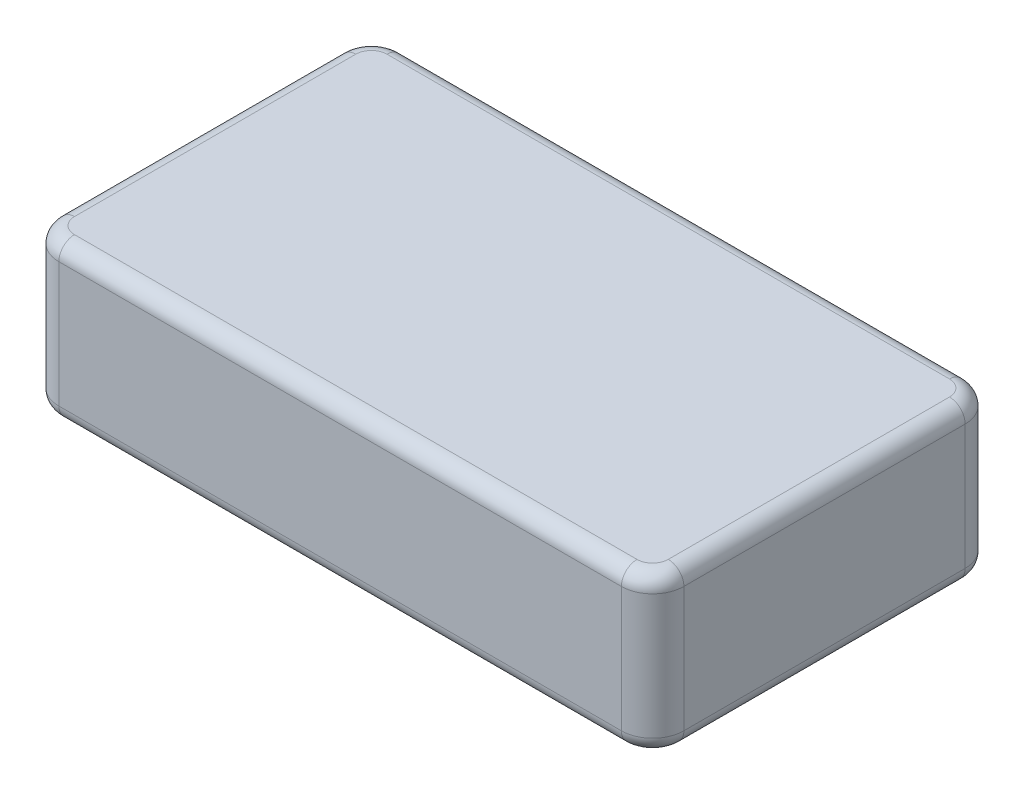
from build123d import *

# Parameters (mm, degrees)
SKETCH_1_W      = 40
SKETCH_1_H      = 22
EXTRUDE_1_DEPTH = 5
FILLET_1_R      = 2
FILLET_2_R      = 1
EXTRUDE_2_DEPTH = 0.5


with BuildPart() as part:
    # 草图1 → 凸台-拉伸1 (new, symmetric)
    with BuildSketch(Plane(origin=(0, 0, 0), x_dir=(1, 0, 0), z_dir=(0, 1, 0))):
        Rectangle(SKETCH_1_W, SKETCH_1_H)
    extrude(amount=EXTRUDE_1_DEPTH, both=True)

    # 圆角1
    fillet_1_edges = [part.edges().sort_by_distance(p)[0] for p in [
        (20, 0, 11),
        (-20, 0, 11),
        (-20, 0, -11),
        (20, 0, -11),
    ]]
    fillet(fillet_1_edges, radius=FILLET_1_R)

    # 圆角2
    fillet_2_edges = [part.edges().sort_by_distance(p)[0] for p in [
        (-20, -5, 0),
        (-20, 5, 0),
        (20, -5, 0),
        (0, -5, 11),
        (0, -5, -11),
        (-19.414213562, -5, 10.414213562),
        (19.414213562, -5, 10.414213562),
        (19.414213562, -5, -10.414213562),
        (-19.414213562, -5, -10.414213562),
        (0, 5, -11),
        (20, 5, 0),
        (0, 5, 11),
        (-19.414213562, 5, 10.414213562),
        (19.414213562, 5, 10.414213562),
        (19.414213562, 5, -10.414213562),
        (-19.414213562, 5, -10.414213562),
    ]]
    fillet(fillet_2_edges, radius=FILLET_2_R)

    # 草图2 → 凸台-拉伸2 (add)
    # profile 1 of 8: a face of its own
    with BuildSketch(Plane.XZ.offset(5)):
        with BuildLine():
            Line((-11.463180367, 4.470079286), (-11.35280321, 4.470079286))
            Line((-11.35280321, 4.470079286), (-11.363244292, -0.877246519))
            add(Edge.make_bspline(
                [(-11.363244292, -0.877246519), (-11.364433727, -0.925471097), (-11.366714337, -1.017936358), (-11.366899427, -1.150230165), (-11.371250251, -1.270009938), (-11.371596794, -1.377447166), (-11.374831997, -1.472401495), (-11.378573196, -1.554892793), (-11.378928682, -1.625075691), (-11.385546196, -1.734920983), (-11.39343184, -1.885950069), (-11.412987831, -2.04150746), (-11.428555871, -2.152348611), (-11.444382066, -2.20280544), (-11.464432231, -2.242728536), (-11.484442257, -2.238072767), (-11.493012032, -2.236078822)],
                knots=[0, 0, 0, 0, 1.45038606, 2.780953852, 3.977268029, 5.053718292, 6.010937745, 6.833690271, 7.536464333, 8.120251454, 10.142880859, 12.069479857, 12.873132744, 13.440417135, 13.76034519, 14, 14, 14, 14], degree=3))
            add(Edge.make_bspline(
                [(-11.493012032, -2.236078822), (-11.49499309, -2.234579297), (-11.503472504, -2.228160962), (-11.523693558, -2.214575707), (-11.547720341, -2.178159628), (-11.558237764, -2.145489513), (-11.564608026, -2.125701665)],
                knots=[0, 0, 0, 0, 0.221265066, 0.947068446, 2.150880552, 4, 4, 4, 4], degree=3))
            Line((-11.564608026, -2.125701665), (-11.613830272, -1.994442342))
            Line((-11.613830272, -1.994442342), (-11.725699012, -1.631987622))
            add(Edge.make_bspline(
                [(-11.725699012, -1.631987622), (-11.739165596, -1.597884368), (-11.762623689, -1.538478259), (-11.786287728, -1.460321271), (-11.804240066, -1.410414734), (-11.809011652, -1.369963314), (-11.786026897, -1.332019775), (-11.769099414, -1.273598294), (-11.743052539, -1.199027119), (-11.718455368, -1.111012925), (-11.696730265, -1.015914979), (-11.677159735, -0.913164637), (-11.666068554, -0.797399171), (-11.660627898, -0.686867453), (-11.656452518, -0.580448584), (-11.655693916, -0.477996857), (-11.65360159, -0.356690879), (-11.653928451, -0.269179111), (-11.654103018, -0.22244149)],
                knots=[0, 0, 0, 0, 1.220359697, 2.125803599, 2.712350858, 2.994193817, 3.439826662, 4.12562012, 5.031064022, 6.063176816, 7.167225426, 8.277459231, 9.542238136, 11.034069985, 11.961482632, 13.08703073, 14.444263491, 16, 16, 16, 16], degree=3))
            Line((-11.654103018, -0.22244149), (-11.645153519, 3.724287681))
            Line((-11.645153519, 3.724287681), (-12.168699225, 3.270846386))
            Line((-12.168699225, 3.270846386), (-12.208971972, 3.442378455))
            add(Edge.make_bspline(
                [(-12.208971972, 3.442378455), (-12.166415094, 3.486352693), (-12.086640472, 3.568784216), (-11.980026215, 3.687470795), (-11.892339718, 3.790471946), (-11.801008381, 3.910885116), (-11.69875253, 4.060738558), (-11.623239811, 4.183854517), (-11.583998607, 4.247833388)],
                knots=[0, 0, 0, 0, 1.077185482, 2.019228619, 2.808185376, 3.45765616, 4.678836699, 6, 6, 6, 6], degree=3))
            Line((-11.583998607, 4.247833388), (-11.463180367, 4.470079286))
        make_face()
    # profile 2 of 8: a face of its own
    with BuildSketch(Plane.XZ.offset(5)):
        with BuildLine():
            Line((-7.252440968, 3.804833174), (-7.15101331, 4.419365457))
            Line((-7.15101331, 4.419365457), (-7.051077235, 4.408924374))
            Line((-7.051077235, 4.408924374), (-7.051077235, 1.8926235))
            Line((-7.051077235, 1.8926235), (-7.171895475, 1.882182418))
            Line((-7.171895475, 1.882182418), (-7.241999886, 2.948664412))
            add(Edge.make_bspline(
                [(-7.241999886, 2.948664412), (-7.251230124, 3.007968799), (-7.268292508, 3.117594818), (-7.301738404, 3.266053077), (-7.332759539, 3.387541669), (-7.380828306, 3.510659482), (-7.452159697, 3.642103754), (-7.557230502, 3.782991336), (-7.683296615, 3.909902274), (-7.832796244, 4.009735), (-7.99483236, 4.086035606), (-8.111329585, 4.10053655), (-8.168273059, 4.107624566)],
                knots=[0, 0, 0, 0, 1.116474761, 2.063838624, 2.831507158, 3.446633667, 4.518832044, 5.603216916, 6.708904972, 7.82779241, 8.938231816, 10, 10, 10, 10], degree=3))
            add(Edge.make_bspline(
                [(-8.168273059, 4.107624566), (-8.202199609, 4.106170345), (-8.271854791, 4.10318466), (-8.359291092, 4.08262072), (-8.433807942, 4.05534785), (-8.49543369, 4.020260484), (-8.563216797, 3.973267463), (-8.634025203, 3.914929994), (-8.70522405, 3.848270132), (-8.768370699, 3.770801267), (-8.823805048, 3.68596951), (-8.883248321, 3.563689316), (-8.94244072, 3.407835835), (-8.981570995, 3.24641308), (-8.998674889, 3.111472788), (-9.009180932, 2.997545733), (-9.015927404, 2.869677371), (-9.021846248, 2.731415628), (-9.016759472, 2.588972316), (-8.996234561, 2.449675575), (-8.959281819, 2.3171441), (-8.922080401, 2.234784536), (-8.903623581, 2.193923309)],
                knots=[0, 0, 0, 0, 0.864038106, 1.773971445, 2.275285977, 2.88209936, 3.574564674, 4.376127188, 5.218616224, 6.055847121, 6.916999662, 7.795414815, 9.515900782, 11.157236165, 12.013901558, 12.981067707, 14.072720019, 15.277182195, 16.507433409, 17.699229733, 18.858513907, 20, 20, 20, 20], degree=3))
            add(Edge.make_bspline(
                [(-8.903623581, 2.193923309), (-8.882726653, 2.156032051), (-8.841974449, 2.082138303), (-8.765758207, 1.983759812), (-8.676249517, 1.904026448), (-8.550524343, 1.822791793), (-8.39971426, 1.750189319), (-8.28084123, 1.702183733), (-8.227936387, 1.680818685)],
                knots=[0, 0, 0, 0, 0.892298636, 1.740118821, 2.553971753, 3.353728668, 4.822268012, 6, 6, 6, 6], degree=3))
            Line((-8.227936387, 1.680818685), (-7.87592275, 1.53911828))
            add(Edge.make_bspline(
                [(-7.87592275, 1.53911828), (-7.83249313, 1.519089293), (-7.748872161, 1.480524754), (-7.631016113, 1.419174004), (-7.524313447, 1.358506249), (-7.401541829, 1.276335251), (-7.266262163, 1.168413003), (-7.132590938, 1.019572858), (-7.023970429, 0.850894785), (-6.9558369, 0.654218539), (-6.902174113, 0.440857725), (-6.865940441, 0.209071692), (-6.842017735, -0.043979631), (-6.832402249, -0.314712767), (-6.836660716, -0.594482192), (-6.872423567, -0.7771162), (-6.889986249, -0.866805436)],
                knots=[0, 0, 0, 0, 0.703245545, 1.354054533, 1.953549274, 2.507188807, 3.525842386, 4.488918984, 5.43838142, 6.454223102, 7.53246407, 8.673253088, 9.899948524, 11.268249991, 12.658472344, 14, 14, 14, 14], degree=3))
            add(Edge.make_bspline(
                [(-6.889986249, -0.866805436), (-6.911945081, -0.956752212), (-6.954478009, -1.130973658), (-7.046499098, -1.33114094), (-7.127161499, -1.472686505), (-7.186918057, -1.564418114), (-7.246670865, -1.643249008), (-7.324763586, -1.735762158), (-7.445204521, -1.833283983), (-7.585722589, -1.910941335), (-7.71506889, -1.959222455), (-7.822430981, -1.986825077), (-7.937703924, -2.000815947), (-8.017094569, -2.003502646), (-8.057895901, -2.004883425)],
                knots=[0, 0, 0, 0, 1.868422262, 3.619020558, 4.429541533, 5.162879566, 5.830420081, 6.429075538, 7.606854402, 8.938752151, 9.657684361, 10.394048182, 11.174651193, 12, 12, 12, 12], degree=3))
            add(Edge.make_bspline(
                [(-8.057895901, -2.004883425), (-8.103713806, -2.004591956), (-8.193393601, -2.004021462), (-8.324601132, -1.982799772), (-8.448417204, -1.943958618), (-8.56371719, -1.886206875), (-8.671552224, -1.814074832), (-8.771702968, -1.728509937), (-8.864326934, -1.630415114), (-8.951791094, -1.521687921), (-9.028402709, -1.398915711), (-9.097628977, -1.265389106), (-9.156840309, -1.120421395), (-9.223225376, -0.915823375), (-9.281560046, -0.655911406), (-9.298245385, -0.445484278), (-9.306351047, -0.34325973)],
                knots=[0, 0, 0, 0, 0.833862414, 1.63212638, 2.411403016, 3.189256699, 3.973153178, 4.770028097, 5.583768076, 6.428386665, 7.307987397, 8.215552436, 9.166047206, 10.157242313, 12.13320567, 14, 14, 14, 14], degree=3))
            Line((-9.306351047, -0.34325973), (-9.346623794, 0.190727059))
            Line((-9.346623794, 0.190727059), (-9.204923389, 0.190727059))
            add(Edge.make_bspline(
                [(-9.204923389, 0.190727059), (-9.196772342, 0.12754067), (-9.181090881, 0.005979003), (-9.153537365, -0.169375458), (-9.126979253, -0.331018364), (-9.093030426, -0.524196273), (-9.039920895, -0.742411992), (-8.956252369, -0.979559783), (-8.846993993, -1.187676192), (-8.730263854, -1.333871748), (-8.629879718, -1.435582083), (-8.549852047, -1.49397606), (-8.471895104, -1.544420245), (-8.366240942, -1.587565317), (-8.234595809, -1.622038622), (-8.128714356, -1.621707412), (-8.077286483, -1.62154654)],
                knots=[0, 0, 0, 0, 1.134650933, 2.182907786, 3.161205505, 4.052250561, 5.675932663, 7.155002512, 8.52184542, 9.839854562, 10.472309825, 11.060302883, 11.600982628, 12.120735338, 13.087218943, 14, 14, 14, 14], degree=3))
            add(Edge.make_bspline(
                [(-8.077286483, -1.62154654), (-8.031892636, -1.619923985), (-7.944815156, -1.616811493), (-7.820289544, -1.590381088), (-7.706854122, -1.54987681), (-7.606904915, -1.487707716), (-7.517269334, -1.41266666), (-7.436389276, -1.32489877), (-7.362262679, -1.226042939), (-7.300448189, -1.115062073), (-7.245876258, -1.000342763), (-7.201023956, -0.886322047), (-7.167753355, -0.774994556), (-7.145196966, -0.665098586), (-7.129898017, -0.551454266), (-7.122101588, -0.430384314), (-7.116415775, -0.299030258), (-7.119547333, -0.208521661), (-7.121181646, -0.161286578)],
                knots=[0, 0, 0, 0, 1.108065456, 2.12556444, 3.098260599, 4.035950869, 4.98490885, 5.94776606, 6.946521194, 7.996930623, 9.045863326, 10.049925535, 10.987930625, 11.881525266, 12.788809675, 13.787786499, 14.845478855, 16, 16, 16, 16], degree=3))
            add(Edge.make_bspline(
                [(-7.121181646, -0.161286578), (-7.126403599, -0.087563248), (-7.136149978, 0.050035759), (-7.167755212, 0.239418723), (-7.206335914, 0.398492316), (-7.257818683, 0.529244622), (-7.320365384, 0.637345224), (-7.386100027, 0.734509944), (-7.460190371, 0.821150517), (-7.544608464, 0.896624932), (-7.637352498, 0.966590798), (-7.741777681, 1.031653936), (-7.858738474, 1.093459016), (-7.942736644, 1.128604625), (-7.986299907, 1.146831896)],
                knots=[0, 0, 0, 0, 1.578487453, 2.946127177, 4.097996722, 5.070650713, 5.936469873, 6.761635482, 7.575228913, 8.364955199, 9.176673428, 10.055112166, 10.991339211, 12, 12, 12, 12], degree=3))
            Line((-7.986299907, 1.146831896), (-8.420350621, 1.307922883))
            add(Edge.make_bspline(
                [(-8.420350621, 1.307922883), (-8.487892576, 1.337447953), (-8.621732798, 1.395954433), (-8.804413358, 1.514283086), (-8.963594882, 1.657526044), (-9.091779511, 1.831402315), (-9.190214766, 2.033848681), (-9.250352887, 2.223514755), (-9.283849163, 2.393915365), (-9.298752274, 2.539161665), (-9.308542739, 2.698941461), (-9.307104871, 2.809931009), (-9.306351047, 2.868118919)],
                knots=[0, 0, 0, 0, 1.141640751, 2.262259852, 3.359181592, 4.444772656, 5.58953336, 6.835542724, 7.519006772, 8.279340868, 9.097919025, 10, 10, 10, 10], degree=3))
            add(Edge.make_bspline(
                [(-9.306351047, 2.868118919), (-9.305925963, 2.918353807), (-9.305104238, 3.015462225), (-9.294660511, 3.155946738), (-9.276914968, 3.285422168), (-9.245118936, 3.443489249), (-9.188221608, 3.629118093), (-9.099836865, 3.836926601), (-8.997415409, 4.022544305), (-8.879669535, 4.178198258), (-8.745240753, 4.299897857), (-8.622852218, 4.38414771), (-8.511672335, 4.434185755), (-8.41633746, 4.461240875), (-8.310373872, 4.475016823), (-8.236422821, 4.47765948), (-8.198104723, 4.479028785)],
                knots=[0, 0, 0, 0, 0.971164436, 1.877345498, 2.721647718, 3.496542433, 4.992871533, 6.466013358, 7.856401207, 9.083219229, 10.219456221, 11.349985082, 11.939558551, 12.569451447, 13.258754286, 14, 14, 14, 14], degree=3))
            add(Edge.make_bspline(
                [(-8.198104723, 4.479028785), (-8.155156342, 4.474143087), (-8.069737866, 4.464426099), (-7.944449387, 4.430469728), (-7.823247224, 4.381714194), (-7.710055296, 4.31552773), (-7.605953866, 4.241830743), (-7.512285006, 4.165336614), (-7.435727596, 4.082571345), (-7.393597122, 4.024020467), (-7.373259208, 3.995755825)],
                knots=[0, 0, 0, 0, 1.049956055, 2.088219507, 3.145806661, 4.218152357, 5.268178035, 6.24663062, 7.15358473, 8, 8, 8, 8], degree=3))
            Line((-7.373259208, 3.995755825), (-7.252440968, 3.804833174))
        make_face()
    # profile 3 of 8: a face of its own
    with BuildSketch(Plane.XZ.offset(5)):
        with BuildLine():
            Line((-6.080056566, 0.38164971), (-5.980120491, 0.553181779))
            add(Edge.make_bspline(
                [(-5.980120491, 0.553181779), (-5.973229734, 0.568130989), (-5.957309316, 0.602669674), (-5.928208924, 0.66073814), (-5.894885993, 0.733300376), (-5.854011101, 0.819265294), (-5.805942301, 0.918805937), (-5.753463044, 1.033476572), (-5.690988637, 1.160391311), (-5.60485126, 1.344271223), (-5.497936478, 1.567842797), (-5.38483143, 1.819527028), (-5.287960726, 2.039117584), (-5.203237604, 2.239245105), (-5.12351115, 2.443153311), (-5.035497159, 2.672175726), (-4.937099562, 2.938889275), (-4.830591917, 3.232020715), (-4.724543816, 3.53179601), (-4.630420371, 3.818210376), (-4.550850014, 4.080677594), (-4.486305585, 4.320604962), (-4.434340862, 4.539724107), (-4.389711126, 4.73968668), (-4.358247011, 4.92244518), (-4.344401867, 5.03880897), (-4.337887378, 5.093561067)],
                knots=[0, 0, 0, 0, 0.244516093, 0.564930459, 0.96472419, 1.430561812, 1.978960196, 2.606759885, 3.303777118, 4.080173153, 5.623132533, 6.985021271, 8.17890921, 9.188507767, 10.21304389, 11.431087032, 12.833237307, 14.436024036, 16.06415384, 17.556631416, 18.914207354, 20.137880512, 21.24677126, 22.25939112, 23.180999631, 24, 24, 24, 24], degree=3))
            Line((-4.337887378, 5.093561067), (-4.308055714, 5.476897952))
            Line((-4.308055714, 5.476897952), (-4.217069138, 5.53656128))
            Line((-4.217069138, 5.53656128), (-3.945600994, 4.872806752))
            Line((-3.945600994, 4.872806752), (-3.885937666, 4.720665265))
            add(Edge.make_bspline(
                [(-3.885937666, 4.720665265), (-3.889208177, 4.71211331), (-3.897421407, 4.690636797), (-3.920004244, 4.654323621), (-3.953770631, 4.607830155), (-3.991286325, 4.562317687), (-4.026499047, 4.515134841), (-4.053477025, 4.463591072), (-4.085282997, 4.400688388), (-4.119209883, 4.325064582), (-4.154557279, 4.236648468), (-4.193676511, 4.13633208), (-4.23530177, 4.022902001), (-4.292706379, 3.859222047), (-4.361571538, 3.659763991), (-4.436871458, 3.437216326), (-4.507704971, 3.244592827), (-4.550751823, 3.124694381), (-4.570574358, 3.069482652)],
                knots=[0, 0, 0, 0, 0.244348517, 0.613632105, 1.137397843, 1.780870594, 2.190305121, 2.707964573, 3.332066687, 4.075639541, 4.922191972, 5.877374831, 6.953848167, 8.151865336, 10.514042256, 12.594594908, 14.431853713, 16, 16, 16, 16], degree=3))
            add(Edge.make_bspline(
                [(-4.570574358, 3.069482652), (-4.48465527, 3.086242071), (-4.31841651, 3.118668683), (-4.082637453, 3.192741427), (-3.866753275, 3.283582265), (-3.737400627, 3.3631757), (-3.67413285, 3.402105708)],
                knots=[0, 0, 0, 0, 1.090250196, 2.109447895, 3.075310551, 4, 4, 4, 4], degree=3))
            Line((-3.67413285, 3.402105708), (-3.392223623, 3.109755399))
            add(Edge.make_bspline(
                [(-3.392223623, 3.109755399), (-3.38073074, 3.095927622), (-3.359909509, 3.070876351), (-3.333292413, 3.036746084), (-3.320462645, 3.006467616), (-3.313905355, 2.974679614), (-3.340666332, 2.937656371), (-3.373037261, 2.932393282), (-3.392223623, 2.929273831)],
                knots=[0, 0, 0, 0, 1.306481079, 2.366903289, 3.110205161, 3.69158161, 4.631792372, 6, 6, 6, 6], degree=3))
            Line((-3.392223623, 2.929273831), (-4.369210625, 2.757741762))
            Line((-4.369210625, 2.757741762), (-4.721224263, 2.677196268))
            add(Edge.make_bspline(
                [(-4.721224263, 2.677196268), (-4.752914498, 2.603555279), (-4.812142717, 2.465922203), (-4.89674948, 2.274564978), (-4.972494327, 2.113492275), (-5.021342399, 2.016829784), (-5.043406236, 1.973168994)],
                knots=[0, 0, 0, 0, 1.242291702, 2.321810586, 3.241990604, 4, 4, 4, 4], degree=3))
            Line((-5.043406236, 1.973168994), (-5.234328887, 1.579391027))
            Line((-5.234328887, 1.579391027), (-5.395419873, 1.248259554))
            Line((-5.395419873, 1.248259554), (-5.164224476, 1.267650136))
            Line((-5.164224476, 1.267650136), (-4.812210838, 1.328805047))
            Line((-4.812210838, 1.328805047), (-4.428873954, 1.41830004))
            add(Edge.make_bspline(
                [(-4.428873954, 1.41830004), (-4.360072182, 1.435517853), (-4.228101185, 1.468543919), (-4.041866887, 1.526678452), (-3.874971317, 1.588364105), (-3.773265491, 1.636852692), (-3.724846679, 1.65993652)],
                knots=[0, 0, 0, 0, 1.140766297, 2.188142296, 3.137433886, 4, 4, 4, 4], degree=3))
            Line((-3.724846679, 1.65993652), (-3.43249637, 1.409350541))
            add(Edge.make_bspline(
                [(-3.43249637, 1.409350541), (-3.415847991, 1.391726651), (-3.387168405, 1.361366585), (-3.3638708, 1.306471829), (-3.388967822, 1.255703405), (-3.423001176, 1.251009298), (-3.442937452, 1.248259554)],
                knots=[0, 0, 0, 0, 1.314229091, 2.263977021, 2.983061283, 4, 4, 4, 4], degree=3))
            Line((-3.442937452, 1.248259554), (-3.966483159, 1.157272978))
            Line((-3.966483159, 1.157272978), (-4.358769543, 1.066286403))
            Line((-4.358769543, 1.066286403), (-4.358769543, -0.273155319))
            add(Edge.make_bspline(
                [(-4.358769543, -0.273155319), (-4.28699984, -0.252850609), (-4.149563582, -0.213967861), (-3.956295827, -0.149459154), (-3.785510591, -0.079666484), (-3.682725071, -0.02580278), (-3.633860103, -0.000195592)],
                knots=[0, 0, 0, 0, 1.152651784, 2.207284424, 3.147730245, 4, 4, 4, 4], degree=3))
            Line((-3.633860103, -0.000195592), (-3.392223623, -0.273155319))
            add(Edge.make_bspline(
                [(-3.392223623, -0.273155319), (-3.375404327, -0.293837289), (-3.346691993, -0.329143619), (-3.330818736, -0.38930449), (-3.352462809, -0.4408557), (-3.38486158, -0.449104288), (-3.402664706, -0.453636887)],
                knots=[0, 0, 0, 0, 1.37897393, 2.354055748, 3.095553551, 4, 4, 4, 4], degree=3))
            Line((-3.402664706, -0.453636887), (-3.894887165, -0.544623463))
            Line((-3.894887165, -0.544623463), (-4.388601207, -0.644559538))
            Line((-4.388601207, -0.644559538), (-4.428873954, -2.960988262))
            Line((-4.428873954, -2.960988262), (-3.351950877, -1.86318302))
            Line((-3.351950877, -1.86318302), (-3.281846466, -2.013832924))
            add(Edge.make_bspline(
                [(-3.281846466, -2.013832924), (-3.372953979, -2.132570203), (-3.549597128, -2.362783127), (-3.804405153, -2.698960839), (-4.043016217, -3.012470028), (-4.194826444, -3.215452949), (-4.267782967, -3.313001899)],
                knots=[0, 0, 0, 0, 1.101182503, 2.135019819, 3.103733175, 4, 4, 4, 4], degree=3))
            Line((-4.267782967, -3.313001899), (-4.519860529, -3.665015536))
            add(Edge.make_bspline(
                [(-4.519860529, -3.665015536), (-4.540089633, -3.692381208), (-4.574519436, -3.7389574), (-4.602749446, -3.801700509), (-4.634504305, -3.835712586), (-4.63102993, -3.853397234), (-4.630237687, -3.85742977)],
                knots=[0, 0, 0, 0, 1.798205281, 3.060533554, 3.785778425, 4, 4, 4, 4], degree=3))
            Line((-4.630237687, -3.85742977), (-4.700342098, -3.766443195))
            Line((-4.700342098, -3.766443195), (-4.901705831, -3.535247797))
            add(Edge.make_bspline(
                [(-4.901705831, -3.535247797), (-4.914551792, -3.519838111), (-4.937116539, -3.492770018), (-4.967187122, -3.457819581), (-4.982321117, -3.430840754), (-4.991431009, -3.407592493), (-4.975473716, -3.384822903), (-4.952474188, -3.357286782), (-4.917605123, -3.314924583), (-4.867844788, -3.266500769), (-4.816445329, -3.200078016), (-4.776743413, -3.112390625), (-4.747639384, -3.007689886), (-4.725189642, -2.849120234), (-4.705782606, -2.65406311), (-4.695963629, -2.499128308), (-4.691392598, -2.427001473)],
                knots=[0, 0, 0, 0, 0.696593583, 1.223610949, 1.578128759, 1.791090136, 2.02207918, 2.463047155, 3.073701498, 3.901904514, 4.872944166, 5.958838381, 7.21224812, 8.624664229, 11.497618683, 14, 14, 14, 14], degree=3))
            Line((-4.691392598, -2.427001473), (-4.651119852, -0.725105031))
            add(Edge.make_bspline(
                [(-4.651119852, -0.725105031), (-4.795383383, -0.762101117), (-5.077732688, -0.834509014), (-5.359195369, -0.910289647), (-5.496847531, -0.94735093)],
                knots=[0, 0, 0, 0, 1.021879835, 2, 2, 2, 2], degree=3))
            Line((-5.496847531, -0.94735093), (-5.787706257, -0.655000621))
            add(Edge.make_bspline(
                [(-5.787706257, -0.655000621), (-5.79609914, -0.644501058), (-5.812590529, -0.623870201), (-5.826917446, -0.59161496), (-5.818617634, -0.560929022), (-5.789678431, -0.546504448), (-5.749990031, -0.533158597), (-5.717328316, -0.527218225), (-5.698211265, -0.523741298)],
                knots=[0, 0, 0, 0, 1.068064254, 2.09866661, 2.632698737, 3.395044859, 4.475307756, 6, 6, 6, 6], degree=3))
            Line((-5.698211265, -0.523741298), (-5.505797031, -0.504350716))
            add(Edge.make_bspline(
                [(-5.505797031, -0.504350716), (-5.425177588, -0.494984529), (-5.270505899, -0.477015116), (-5.048708234, -0.441914135), (-4.847099216, -0.397486467), (-4.72055885, -0.360797828), (-4.660069351, -0.34325973)],
                knots=[0, 0, 0, 0, 1.129412521, 2.166823975, 3.123695448, 4, 4, 4, 4], degree=3))
            Line((-4.660069351, -0.34325973), (-4.660069351, 1.026013656))
            add(Edge.make_bspline(
                [(-4.660069351, 1.026013656), (-4.694309754, 1.017276624), (-4.751231986, 1.002751931), (-4.808701511, 0.990587912), (-4.83160142, 0.985740909)],
                knots=[0, 0, 0, 0, 1.203059061, 2, 2, 2, 2], degree=3))
            Line((-4.83160142, 0.985740909), (-5.062796817, 0.915636499))
            Line((-5.062796817, 0.915636499), (-5.204497222, 0.875363752))
            Line((-5.204497222, 0.875363752), (-5.446133702, 1.146831896))
            add(Edge.make_bspline(
                [(-5.446133702, 1.146831896), (-5.457298751, 1.131067014), (-5.485228638, 1.09163043), (-5.528042993, 1.015370715), (-5.590607612, 0.917206799), (-5.658552025, 0.797572626), (-5.730303946, 0.67506333), (-5.798343862, 0.562747493), (-5.85543966, 0.466132599), (-5.892008367, 0.407934624), (-5.908524497, 0.38164971)],
                knots=[0, 0, 0, 0, 0.51821696, 1.296343826, 2.344566462, 3.642306328, 4.988078142, 6.155268441, 7.166833366, 8, 8, 8, 8], degree=3))
            Line((-5.908524497, 0.38164971), (-5.98906999, 0.271272552))
            Line((-5.98906999, 0.271272552), (-6.080056566, 0.38164971))
        make_face()
    # profile 4 of 8: a face of its own
    with BuildSketch(Plane.XZ.offset(5)):
        with BuildLine():
            Line((-2.002068073, -3.374156811), (-2.002068073, -1.752805862))
            add(Edge.make_bspline(
                [(-2.002068073, -1.752805862), (-2.06824303, -1.763467317), (-2.207785282, -1.785948983), (-2.427759908, -1.827400946), (-2.670474149, -1.873202189), (-2.83986791, -1.90679343), (-2.928341245, -1.924337931)],
                knots=[0, 0, 0, 0, 0.853755862, 1.800303615, 2.851111907, 4, 4, 4, 4], degree=3))
            Line((-2.928341245, -1.924337931), (-3.120755479, -1.702092033))
            add(Edge.make_bspline(
                [(-3.120755479, -1.702092033), (-3.136835225, -1.683885093), (-3.164880055, -1.652130205), (-3.198740473, -1.609345002), (-3.217145685, -1.577795787), (-3.224696129, -1.546680701), (-3.197915568, -1.52111765), (-3.174246798, -1.514734342), (-3.161028226, -1.511169383)],
                knots=[0, 0, 0, 0, 1.696127462, 2.958231267, 3.780199993, 4.270545426, 5.034131512, 6, 6, 6, 6], degree=3))
            Line((-3.161028226, -1.511169383), (-2.536054861, -1.450014471))
            Line((-2.536054861, -1.450014471), (-1.982677491, -1.37991006))
            Line((-1.982677491, -1.37991006), (-1.982677491, 0.14001323))
            Line((-1.982677491, 0.14001323), (-2.777691341, 0.059467737))
            Line((-2.777691341, 0.059467737), (-2.788132424, -0.262714237))
            add(Edge.make_bspline(
                [(-2.788132424, -0.262714237), (-2.787781378, -0.295039368), (-2.787138494, -0.354237636), (-2.791072399, -0.434740658), (-2.793231512, -0.498485073), (-2.797392337, -0.545799283), (-2.803193453, -0.579632737), (-2.81072664, -0.601861252), (-2.822820441, -0.616935768), (-2.842555464, -0.616181502), (-2.860045781, -0.594625786), (-2.879590839, -0.559014293), (-2.902830597, -0.502778898), (-2.919076931, -0.459134246), (-2.928341245, -0.434246306)],
                knots=[0, 0, 0, 0, 2.014923643, 3.690007919, 5.024398433, 5.98985136, 6.652530555, 7.153331904, 7.460204618, 7.770192871, 8.231023539, 9.092322426, 10.341925023, 12, 12, 12, 12], degree=3))
            Line((-2.928341245, -0.434246306), (-3.110314397, 0.049026654))
            add(Edge.make_bspline(
                [(-3.110314397, 0.049026654), (-3.122801024, 0.078638524), (-3.144698358, 0.13056776), (-3.16621795, 0.199738515), (-3.18479119, 0.243982732), (-3.192466076, 0.274161097), (-3.187567668, 0.299325857), (-3.175227729, 0.329159052), (-3.162259694, 0.372564212), (-3.127054439, 0.447638899), (-3.093120356, 0.569655519), (-3.078841579, 0.740850648), (-3.070284587, 0.930048167), (-3.063179799, 1.061313051), (-3.059600568, 1.127441314)],
                knots=[0, 0, 0, 0, 1.042973245, 1.829023414, 2.3447337, 2.607467447, 2.819750817, 3.161742933, 3.656837014, 4.28628164, 5.849242264, 7.733156719, 9.850461401, 12, 12, 12, 12], degree=3))
            Line((-3.059600568, 1.127441314), (-3.049159485, 1.439182205))
            add(Edge.make_bspline(
                [(-3.049159485, 1.439182205), (-3.049159485, 1.445645732), (-3.049159485, 1.459069981), (-3.049159485, 1.47249423), (-3.049159485, 1.479454952)],
                knots=[0, 0, 0, 0, 0.962962963, 2, 2, 2, 2], degree=3))
            Line((-3.049159485, 1.479454952), (-3.07004165, 2.244637138))
            Line((-3.07004165, 2.244637138), (-3.089432232, 3.302169633))
            add(Edge.make_bspline(
                [(-3.089432232, 3.302169633), (-3.091446471, 3.329016063), (-3.096293931, 3.393624581), (-3.104016091, 3.506947456), (-3.110258796, 3.65274958), (-3.121112662, 3.817713073), (-3.129011812, 3.977343892), (-3.135397198, 4.106103905), (-3.138112001, 4.191652126), (-3.13964204, 4.233912211), (-3.140146061, 4.247833388)],
                knots=[0, 0, 0, 0, 0.682236145, 1.641866936, 2.87822235, 4.380152655, 5.831064009, 6.928377034, 7.646989543, 8, 8, 8, 8], degree=3))
            Line((-3.140146061, 4.247833388), (-3.180418808, 4.661001936))
            Line((-3.180418808, 4.661001936), (-3.07004165, 4.701274683))
            Line((-3.07004165, 4.701274683), (-2.838846253, 3.874937585))
            Line((-2.838846253, 3.874937585), (-1.800704339, 4.01663799))
            Line((-1.800704339, 4.01663799), (-0.744663427, 4.167287894))
            Line((-0.744663427, 4.167287894), (-0.532858612, 4.519301532))
            add(Edge.make_bspline(
                [(-0.532858612, 4.519301532), (-0.526264984, 4.532707724), (-0.515115224, 4.555377467), (-0.486816229, 4.578383965), (-0.459498433, 4.569200321), (-0.434352081, 4.549966838), (-0.405850389, 4.513793513), (-0.38415874, 4.485972011), (-0.371767625, 4.470079286)],
                knots=[0, 0, 0, 0, 1.175015506, 1.986940007, 2.463021564, 3.263923954, 4.437046816, 6, 6, 6, 6], degree=3))
            Line((-0.371767625, 4.470079286), (-0.210676638, 4.247833388))
            add(Edge.make_bspline(
                [(-0.210676638, 4.247833388), (-0.194131331, 4.222119865), (-0.165422475, 4.17750263), (-0.129795791, 4.117975911), (-0.108522579, 4.077293371), (-0.092684826, 4.047657434), (-0.101590728, 4.017932967), (-0.120554108, 3.982119158), (-0.156518193, 3.933638577), (-0.184340931, 3.896279912), (-0.200235556, 3.874937585)],
                knots=[0, 0, 0, 0, 1.689223804, 2.931083985, 3.802331103, 4.271022733, 4.69059203, 5.426565263, 6.529843446, 8, 8, 8, 8], degree=3))
            add(Edge.make_bspline(
                [(-0.200235556, 3.874937585), (-0.22802328, 3.837285635), (-0.283392431, 3.762261263), (-0.325440359, 3.647220042), (-0.345800666, 3.536752681), (-0.36149624, 3.424191499), (-0.378178314, 3.28202797), (-0.386569207, 3.177411485), (-0.391158207, 3.120196482)],
                knots=[0, 0, 0, 0, 1.059771852, 2.111675951, 2.745759835, 3.613886148, 4.695028686, 6, 6, 6, 6], degree=3))
            Line((-0.391158207, 3.120196482), (-0.583572441, 0.754545512))
            Line((-0.583572441, 0.754545512), (-0.391158207, 0.542740696))
            add(Edge.make_bspline(
                [(-0.391158207, 0.542740696), (-0.376348614, 0.524596768), (-0.350180581, 0.492537081), (-0.32040428, 0.446995073), (-0.299366632, 0.412414346), (-0.295447795, 0.378148813), (-0.303154815, 0.349555599), (-0.319155077, 0.325754444), (-0.344502805, 0.317205164), (-0.377016394, 0.312056274), (-0.424409676, 0.306230885), (-0.461259375, 0.302958765), (-0.482144783, 0.301104216)],
                knots=[0, 0, 0, 0, 1.694644542, 2.994377575, 3.961649825, 4.578694048, 5.435547803, 6.077366126, 6.545991535, 7.316612075, 8.47912864, 10, 10, 10, 10], degree=3))
            Line((-0.482144783, 0.301104216), (-1.086235982, 0.241440888))
            Line((-1.086235982, 0.241440888), (-1.711209347, 0.169844894))
            Line((-1.711209347, 0.169844894), (-1.711209347, -1.350078396))
            add(Edge.make_bspline(
                [(-1.711209347, -1.350078396), (-1.602607887, -1.329697257), (-1.396445072, -1.291006865), (-1.106808466, -1.220704041), (-0.851548339, -1.146569717), (-0.696574671, -1.086104531), (-0.623845187, -1.057728087)],
                knots=[0, 0, 0, 0, 1.175274761, 2.231074541, 3.169839395, 4, 4, 4, 4], degree=3))
            Line((-0.623845187, -1.057728087), (-0.321053796, -1.390351143))
            add(Edge.make_bspline(
                [(-0.321053796, -1.390351143), (-0.305950275, -1.406468416), (-0.281197971, -1.432882103), (-0.276620737, -1.491026193), (-0.328459148, -1.522152236), (-0.367241912, -1.527352871), (-0.391158207, -1.530559964)],
                knots=[0, 0, 0, 0, 1.155803537, 1.89418089, 2.701397579, 4, 4, 4, 4], degree=3))
            Line((-0.391158207, -1.530559964), (-0.986299907, -1.602155958))
            Line((-0.986299907, -1.602155958), (-1.378586291, -1.661819287))
            Line((-1.378586291, -1.661819287), (-1.720158846, -1.712533116))
            Line((-1.720158846, -1.712533116), (-1.720158846, -3.333884064))
            add(Edge.make_bspline(
                [(-1.720158846, -3.333884064), (-1.61920653, -3.32264042), (-1.429627937, -3.301525954), (-1.164061277, -3.269065773), (-0.936442392, -3.23734823), (-0.680431428, -3.200893536), (-0.382036291, -3.138689738), (-0.15475901, -3.060451076), (-0.039144569, -3.02065159)],
                knots=[0, 0, 0, 0, 1.066321, 2.002446715, 2.808504797, 3.478748084, 4.717455934, 6, 6, 6, 6], degree=3))
            Line((-0.039144569, -3.02065159), (0.262155239, -3.38310631))
            add(Edge.make_bspline(
                [(0.262155239, -3.38310631), (0.273257875, -3.399012568), (0.293795939, -3.428436547), (0.310308931, -3.469961443), (0.302915219, -3.505195348), (0.271270704, -3.51895759), (0.228936857, -3.53019809), (0.193286924, -3.533396963), (0.172660246, -3.535247797)],
                knots=[0, 0, 0, 0, 1.324652931, 2.450391455, 2.943479326, 3.58245068, 4.601231309, 6, 6, 6, 6], degree=3))
            Line((0.172660246, -3.535247797), (-0.613404105, -3.594911126))
            Line((-0.613404105, -3.594911126), (-1.499404531, -3.675456619))
            add(Edge.make_bspline(
                [(-1.499404531, -3.675456619), (-1.610795097, -3.689731464), (-1.825200194, -3.717207754), (-2.133943016, -3.759116274), (-2.417511576, -3.798820906), (-2.675587764, -3.839067094), (-2.908393697, -3.87892046), (-3.11560437, -3.919486716), (-3.297774287, -3.957580152), (-3.410182963, -3.984944562), (-3.462328034, -3.997638592)],
                knots=[0, 0, 0, 0, 1.354184149, 2.606540161, 3.75711595, 4.806881164, 5.75607328, 6.605014177, 7.352882372, 8, 8, 8, 8], degree=3))
            Line((-3.462328034, -3.997638592), (-3.754678343, -3.696338784))
            add(Edge.make_bspline(
                [(-3.754678343, -3.696338784), (-3.765895519, -3.682005887), (-3.787968549, -3.653801778), (-3.804190612, -3.610349293), (-3.797431206, -3.573132646), (-3.771562918, -3.552157831), (-3.732760539, -3.54036932), (-3.70208658, -3.537109132), (-3.684573932, -3.535247797)],
                knots=[0, 0, 0, 0, 1.288253221, 2.535009797, 3.149389369, 3.821488417, 4.756224911, 6, 6, 6, 6], degree=3))
            Line((-3.684573932, -3.535247797), (-2.838846253, -3.474092886))
            Line((-2.838846253, -3.474092886), (-2.002068073, -3.374156811))
        make_face()
        Polygon((-1.961795326, 2.214805474), (-1.961795326, 3.613910524), (-2.798573506, 3.493092284), (-2.798573506, 2.073105069), (-2.597209773, 2.102936733), (-2.364522792, 2.13425998), align=None, mode=Mode.SUBTRACT)
        with BuildLine():
            Line((-2.767250259, 0.421922456), (-1.982677491, 0.512909032))
            Line((-1.982677491, 0.512909032), (-1.982677491, 1.861300253))
            add(Edge.make_bspline(
                [(-1.982677491, 1.861300253), (-2.040863413, 1.846458686), (-2.150003699, 1.818620117), (-2.303111487, 1.778411916), (-2.432467895, 1.734806893), (-2.510779562, 1.704899795), (-2.546495944, 1.691259767)],
                knots=[0, 0, 0, 0, 1.222642195, 2.293329976, 3.221621992, 4, 4, 4, 4], degree=3))
            Line((-2.546495944, 1.691259767), (-2.788132424, 1.952286829))
            Line((-2.788132424, 1.952286829), (-2.767250259, 0.421922456))
        make_face(mode=Mode.SUBTRACT)
        with BuildLine():
            Line((-1.711209347, 0.542740696), (-0.865481667, 0.674000019))
            Line((-0.865481667, 0.674000019), (-0.673067433, 3.794392092))
            Line((-0.673067433, 3.794392092), (-1.690327182, 3.65418327))
            Line((-1.690327182, 3.65418327), (-1.690327182, 2.26402772))
            add(Edge.make_bspline(
                [(-1.690327182, 2.26402772), (-1.633410527, 2.278653877), (-1.527131433, 2.305964949), (-1.381372279, 2.355871326), (-1.258621581, 2.405871785), (-1.188304199, 2.446791013), (-1.156340393, 2.465391453)],
                knots=[0, 0, 0, 0, 1.230429821, 2.29755187, 3.226127021, 4, 4, 4, 4], degree=3))
            Line((-1.156340393, 2.465391453), (-0.95497666, 2.234196055))
            add(Edge.make_bspline(
                [(-0.95497666, 2.234196055), (-0.942433962, 2.217416268), (-0.920155752, 2.187612181), (-0.892219621, 2.146801066), (-0.881818042, 2.111532786), (-0.884943324, 2.075366707), (-0.920963973, 2.043400176), (-0.955863294, 2.036681679), (-0.975858825, 2.032832322)],
                knots=[0, 0, 0, 0, 1.360831704, 2.417095319, 3.183568005, 3.703515072, 4.684231218, 6, 6, 6, 6], degree=3))
            Line((-0.975858825, 2.032832322), (-1.378586291, 1.973168994))
            Line((-1.378586291, 1.973168994), (-1.690327182, 1.912014082))
            Line((-1.690327182, 1.912014082), (-1.711209347, 0.542740696))
        make_face(mode=Mode.SUBTRACT)
    # profile 5 of 8: a face of its own
    with BuildSketch(Plane.XZ.offset(5)):
        with BuildLine():
            Line((2.342913815, 3.493092284), (2.474173138, 2.999378242))
            Line((2.474173138, 2.999378242), (2.584550295, 2.566819111))
            Line((2.584550295, 2.566819111), (2.966395597, 2.607091858))
            Line((2.966395597, 2.607091858), (3.77185053, 2.707027933))
            Line((3.77185053, 2.707027933), (3.983655345, 2.747300679))
            Line((3.983655345, 2.747300679), (3.994096428, 3.673573852))
            add(Edge.make_bspline(
                [(3.994096428, 3.673573852), (3.994140314, 3.681529643), (3.9942775, 3.706398799), (3.991933038, 3.757088382), (3.991343935, 3.834681651), (3.987771424, 3.937588329), (3.984213252, 4.062972759), (3.97477691, 4.207183325), (3.961144704, 4.368279017), (3.944051065, 4.543025353), (3.920188608, 4.72566976), (3.882892326, 4.908578397), (3.8333386, 5.088750885), (3.792405934, 5.206142087), (3.77185053, 5.265093136)],
                knots=[0, 0, 0, 0, 0.177294891, 0.554209453, 1.130524385, 1.906506064, 2.848971625, 3.925876191, 5.126764862, 6.452083082, 7.83897123, 9.22979357, 10.608868701, 12, 12, 12, 12], degree=3))
            Line((3.77185053, 5.265093136), (3.862837105, 5.405301958))
            Line((3.862837105, 5.405301958), (4.466928305, 4.720665265))
            add(Edge.make_bspline(
                [(4.466928305, 4.720665265), (4.436525863, 4.651681308), (4.376912004, 4.516415862), (4.324015365, 4.33510498), (4.298356497, 4.173849657), (4.286458335, 4.022292531), (4.277181108, 3.838755762), (4.276418209, 3.705410605), (4.276005654, 3.633301105)],
                knots=[0, 0, 0, 0, 1.215957117, 2.384278755, 3.034624226, 3.848266097, 4.836399765, 6, 6, 6, 6], degree=3))
            Line((4.276005654, 3.633301105), (4.276005654, 2.787573426))
            Line((4.276005654, 2.787573426), (4.769719696, 2.848728337))
            Line((4.769719696, 2.848728337), (5.543851382, 2.959105495))
            Line((5.543851382, 2.959105495), (5.736265616, 2.999378242))
            Line((5.736265616, 2.999378242), (5.906306102, 3.351391879))
            add(Edge.make_bspline(
                [(5.906306102, 3.351391879), (5.91382066, 3.368065831), (5.926571209, 3.396357852), (5.947490405, 3.429197806), (5.959746413, 3.451614413), (5.977976205, 3.460003451), (5.994527772, 3.447454873), (6.015302496, 3.431119637), (6.045528272, 3.40601448), (6.066188091, 3.384439936), (6.077838171, 3.372274044)],
                knots=[0, 0, 0, 0, 1.663720426, 2.822966936, 3.56700533, 3.954602535, 4.461796658, 5.269494342, 6.4602669, 8, 8, 8, 8], degree=3))
            Line((6.077838171, 3.372274044), (6.319474651, 3.1008059))
            add(Edge.make_bspline(
                [(6.319474651, 3.1008059), (6.330957291, 3.084956116), (6.351736654, 3.056273826), (6.378721474, 3.017387713), (6.391643428, 2.982867273), (6.395915754, 2.948406975), (6.3881104, 2.915458474), (6.376951404, 2.884568365), (6.357284965, 2.856938088), (6.333737694, 2.818703416), (6.298190172, 2.763799358), (6.249335744, 2.694129525), (6.199850148, 2.604062316), (6.16087352, 2.491515541), (6.127871639, 2.360302893), (6.114667244, 2.265202205), (6.107669835, 2.214805474)],
                knots=[0, 0, 0, 0, 0.847429402, 1.533536147, 2.036930199, 2.426382901, 3.016860564, 3.480069352, 3.837966044, 4.476237987, 5.424607541, 6.665143789, 8.156530738, 9.850434346, 11.801019622, 14, 14, 14, 14], degree=3))
            Line((6.107669835, 2.214805474), (5.997292678, 1.167714061))
            Line((5.997292678, 1.167714061), (5.866033355, -0.112064332))
            Line((5.866033355, -0.112064332), (5.825760608, -0.434246306))
            Line((5.825760608, -0.434246306), (6.018174842, -0.70571445))
            add(Edge.make_bspline(
                [(6.018174842, -0.70571445), (6.031262201, -0.728490092), (6.052911605, -0.766166075), (6.068139182, -0.819393238), (6.053141081, -0.861423403), (6.029866211, -0.865005891), (6.018174842, -0.866805436)],
                knots=[0, 0, 0, 0, 1.606901506, 2.658172752, 3.325977029, 4, 4, 4, 4], degree=3))
            Line((6.018174842, -0.866805436), (5.857083856, -0.877246519))
            Line((5.857083856, -0.877246519), (4.97108343, -0.957792012))
            Line((4.97108343, -0.957792012), (4.466928305, -1.01745534))
            Line((4.466928305, -1.01745534), (4.255123489, -1.047287005))
            Line((4.255123489, -1.047287005), (4.255123489, -2.134651164))
            add(Edge.make_bspline(
                [(4.255123489, -2.134651164), (4.256984326, -2.245049042), (4.260586178, -2.458736213), (4.280443547, -2.72011346), (4.312679745, -2.913060205), (4.350599807, -3.041875034), (4.406358756, -3.154291834), (4.461220382, -3.244040168), (4.534072161, -3.301989621), (4.616809887, -3.336984418), (4.726007918, -3.367902157), (4.863515472, -3.391870165), (5.02935988, -3.410795437), (5.223022178, -3.423071696), (5.444817383, -3.432550936), (5.602010257, -3.43337969), (5.685551787, -3.433820139)],
                knots=[0, 0, 0, 0, 1.931152807, 3.737957541, 4.577172512, 5.350113142, 6.073531508, 6.773090527, 7.162848559, 7.680298175, 8.332476513, 9.14602524, 10.117846342, 11.250994603, 12.539017008, 14, 14, 14, 14], degree=3))
            add(Edge.make_bspline(
                [(5.685551787, -3.433820139), (5.763612683, -3.434123266), (5.910303827, -3.434692899), (6.115747681, -3.430992765), (6.291945468, -3.420803723), (6.438642736, -3.406141045), (6.557216366, -3.388803923), (6.645289007, -3.363731218), (6.709959422, -3.337217378), (6.767567033, -3.262453307), (6.793310655, -3.135453279), (6.806524098, -3.026422352), (6.813188693, -2.971429344)],
                knots=[0, 0, 0, 0, 1.652015129, 3.104447941, 4.3482727, 5.384821521, 6.227270062, 6.873348196, 7.334536251, 7.663266203, 8.821398446, 10, 10, 10, 10], degree=3))
            Line((6.813188693, -2.971429344), (6.813188693, -2.41656039))
            Line((6.813188693, -2.41656039), (6.813188693, -1.541001047))
            Line((6.813188693, -1.541001047), (6.934006933, -1.521610465))
            Line((6.934006933, -1.521610465), (6.953397515, -1.763246945))
            Line((6.953397515, -1.763246945), (7.004111344, -2.174923911))
            Line((7.004111344, -2.174923911), (7.074215754, -2.719351782))
            Line((7.074215754, -2.719351782), (7.145811748, -3.181742577))
            Line((7.145811748, -3.181742577), (7.195033994, -3.514365632))
            add(Edge.make_bspline(
                [(7.195033994, -3.514365632), (7.200289789, -3.542342659), (7.208738534, -3.587316024), (7.211747984, -3.647392355), (7.185676286, -3.687102423), (7.160255198, -3.698699305), (7.145811748, -3.705288283)],
                knots=[0, 0, 0, 0, 1.559608042, 2.507086382, 3.151774227, 4, 4, 4, 4], degree=3))
            Line((7.145811748, -3.705288283), (7.065266255, -3.73661153))
            add(Edge.make_bspline(
                [(7.065266255, -3.73661153), (7.05588431, -3.740297153), (7.033578547, -3.749059794), (6.99272077, -3.75828074), (6.940784074, -3.770888132), (6.876329179, -3.781886489), (6.800466504, -3.796007937), (6.712717599, -3.808472351), (6.613477917, -3.824254218), (6.391766083, -3.853117978), (6.057862315, -3.886794548), (5.760226915, -3.887108647), (5.615447376, -3.887261435)],
                knots=[0, 0, 0, 0, 0.206618915, 0.491240576, 0.857597671, 1.30390666, 1.832361082, 2.441372039, 3.122534554, 3.89462094, 7.030145068, 10, 10, 10, 10], degree=3))
            add(Edge.make_bspline(
                [(5.615447376, -3.887261435), (5.535389772, -3.886753567), (5.38367125, -3.885791099), (5.168753237, -3.876996332), (4.978624922, -3.86254856), (4.812771628, -3.842205711), (4.67050788, -3.816112594), (4.55244767, -3.784102406), (4.457672794, -3.747207195), (4.368604428, -3.686531294), (4.286813785, -3.603591633), (4.203271543, -3.506787873), (4.137533138, -3.409787711), (4.076043231, -3.273811202), (4.029034224, -3.084616728), (3.989577892, -2.836996838), (3.968545991, -2.563585624), (3.965717669, -2.373829176), (3.964264764, -2.276351569)],
                knots=[0, 0, 0, 0, 1.375107078, 2.605988713, 3.693973982, 4.649466436, 5.475237603, 6.17560074, 6.749778481, 7.211670088, 8.015056038, 8.742243092, 9.407844955, 10.019243034, 11.295622579, 12.740386124, 14.325541172, 16, 16, 16, 16], degree=3))
            Line((3.964264764, -2.276351569), (3.964264764, -1.087559751))
            Line((3.964264764, -1.087559751), (3.661473372, -1.118882999))
            Line((3.661473372, -1.118882999), (2.936563933, -1.229260156))
            Line((2.936563933, -1.229260156), (2.675536871, -1.269532903))
            Line((2.675536871, -1.269532903), (2.665095789, -1.722974198))
            Line((2.665095789, -1.722974198), (2.654654706, -1.98400126))
            add(Edge.make_bspline(
                [(2.654654706, -1.98400126), (2.653193046, -2.023273724), (2.650400147, -2.098314443), (2.62768545, -2.173274802), (2.607027072, -2.236902074), (2.565679042, -2.229087953), (2.541496168, -2.184382652), (2.524909925, -2.14840162), (2.514445884, -2.125701665)],
                knots=[0, 0, 0, 0, 1.721263003, 3.288940973, 3.839377096, 4.198736227, 4.863606649, 6, 6, 6, 6], degree=3))
            Line((2.514445884, -2.125701665), (2.362304397, -1.782637527))
            Line((2.362304397, -1.782637527), (2.262368322, -1.561883212))
            add(Edge.make_bspline(
                [(2.262368322, -1.561883212), (2.252560393, -1.539149027), (2.236985622, -1.503047652), (2.21199309, -1.457472389), (2.222627587, -1.416402593), (2.237371025, -1.36679922), (2.266823473, -1.295061884), (2.28971573, -1.239659227), (2.302641069, -1.208377991)],
                knots=[0, 0, 0, 0, 1.195724136, 1.898783123, 2.330290027, 3.145663464, 4.388395428, 6, 6, 6, 6], degree=3))
            add(Edge.make_bspline(
                [(2.302641069, -1.208377991), (2.310674473, -1.189675246), (2.327817206, -1.149764874), (2.342909772, -1.080628255), (2.355525836, -1.001005807), (2.358695416, -0.881678638), (2.362100287, -0.735563201), (2.365966002, -0.575918462), (2.37147087, -0.447701977), (2.372375305, -0.373592041), (2.37274548, -0.34325973)],
                knots=[0, 0, 0, 0, 0.558699634, 1.192226558, 1.938775613, 2.774002823, 4.470288396, 5.961506424, 7.165668957, 8, 8, 8, 8], degree=3))
            Line((2.37274548, -0.34325973), (2.362304397, 0.411481374))
            Line((2.362304397, 0.411481374), (2.332472733, 1.358636712))
            add(Edge.make_bspline(
                [(2.332472733, 1.358636712), (2.332560133, 1.370570776), (2.332767765, 1.39892171), (2.330602861, 1.447128677), (2.329703575, 1.507319554), (2.32646367, 1.578918103), (2.321607466, 1.662897582), (2.31729865, 1.75886751), (2.313173884, 1.866795998), (2.305110814, 2.019905914), (2.29573089, 2.201877655), (2.286250703, 2.396374438), (2.274719934, 2.551863326), (2.26751415, 2.683287766), (2.254788748, 2.817397113), (2.241038341, 2.982672607), (2.216985263, 3.192225761), (2.201033846, 3.346899332), (2.192263911, 3.431937372)],
                knots=[0, 0, 0, 0, 0.275532466, 0.654563513, 1.113927774, 1.665470852, 2.30930182, 3.056329963, 3.883644582, 4.803233469, 6.596547928, 8.091177521, 9.299307877, 10.196626331, 11.130014446, 12.409513054, 14.025984863, 16, 16, 16, 16], degree=3))
            Line((2.192263911, 3.431937372), (2.342913815, 3.493092284))
        make_face()
        with BuildLine():
            Line((2.675536871, -0.856364354), (3.964264764, -0.70571445))
            Line((3.964264764, -0.70571445), (3.973214263, 0.6933906))
            Line((3.973214263, 0.6933906), (3.701746119, 0.633727272))
            Line((3.701746119, 0.633727272), (3.390005228, 0.553181779))
            Line((3.390005228, 0.553181779), (3.108096002, 0.451754121))
            Line((3.108096002, 0.451754121), (3.037991591, 0.553181779))
            Line((3.037991591, 0.553181779), (2.866459522, 0.773936094))
            add(Edge.make_bspline(
                [(2.866459522, 0.773936094), (2.855977496, 0.785507475), (2.837964244, 0.805392774), (2.825750153, 0.843374201), (2.844339235, 0.875309461), (2.865615292, 0.882167286), (2.876900604, 0.885804834)],
                knots=[0, 0, 0, 0, 1.284117706, 2.206742812, 3.048814964, 4, 4, 4, 4], degree=3))
            Line((2.876900604, 0.885804834), (3.228914242, 0.93502708))
            Line((3.228914242, 0.93502708), (3.64208279, 0.985740909))
            Line((3.64208279, 0.985740909), (3.973214263, 1.046895821))
            Line((3.973214263, 1.046895821), (3.983655345, 2.355014295))
            Line((3.983655345, 2.355014295), (3.682355537, 2.304300466))
            Line((3.682355537, 2.304300466), (3.006668343, 2.214805474))
            Line((3.006668343, 2.214805474), (2.594991378, 2.14320948))
            Line((2.594991378, 2.14320948), (2.614381959, 1.358636712))
            Line((2.614381959, 1.358636712), (2.675536871, -0.856364354))
        make_face(mode=Mode.SUBTRACT)
        with BuildLine():
            Line((4.255123489, -0.665441703), (4.980032929, -0.58489621))
            Line((4.980032929, -0.58489621), (5.323097067, -0.523741298))
            Line((5.323097067, -0.523741298), (5.5244608, -0.483468552))
            Line((5.5244608, -0.483468552), (5.575174629, -0.000195592))
            Line((5.575174629, -0.000195592), (5.655720123, 0.81420884))
            Line((5.655720123, 0.81420884), (5.755656198, 2.043273405))
            Line((5.755656198, 2.043273405), (5.806370027, 2.577260193))
            Line((5.806370027, 2.577260193), (5.33353815, 2.526546364))
            Line((5.33353815, 2.526546364), (4.265564572, 2.384845959))
            Line((4.265564572, 2.384845959), (4.255123489, 1.106559149))
            add(Edge.make_bspline(
                [(4.255123489, 1.106559149), (4.350868813, 1.129399594), (4.528957031, 1.171883277), (4.771980518, 1.245593505), (4.974125691, 1.315299086), (5.089371062, 1.372998552), (5.141123916, 1.398909458)],
                knots=[0, 0, 0, 0, 1.262396956, 2.348083582, 3.25817942, 4, 4, 4, 4], degree=3))
            Line((5.141123916, 1.398909458), (5.414083643, 1.066286403))
            add(Edge.make_bspline(
                [(5.414083643, 1.066286403), (5.427268397, 1.045641069), (5.449960813, 1.010108173), (5.464882779, 0.955847169), (5.44541347, 0.910489177), (5.418025519, 0.907018214), (5.40364256, 0.905195416)],
                knots=[0, 0, 0, 0, 1.442479735, 2.482666664, 3.203162602, 4, 4, 4, 4], degree=3))
            Line((5.40364256, 0.905195416), (5.261942155, 0.894754334))
            Line((5.261942155, 0.894754334), (4.930810683, 0.854481587))
            Line((4.930810683, 0.854481587), (4.60862871, 0.81420884))
            Line((4.60862871, 0.81420884), (4.255123489, 0.74410443))
            Line((4.255123489, 0.74410443), (4.255123489, -0.665441703))
        make_face(mode=Mode.SUBTRACT)
    # profile 6 of 8: a face of its own
    with BuildSketch(Plane.XZ.offset(5)):
        with BuildLine():
            Line((10.695779786, 1.378027293), (10.816598026, 1.318363965))
            Line((10.816598026, 1.318363965), (10.755443114, 1.026013656))
            Line((10.755443114, 1.026013656), (10.534688799, -0.071791586))
            Line((10.534688799, -0.071791586), (11.389365978, 0.57257236))
            Line((11.389365978, 0.57257236), (11.389365978, 2.003000658))
            add(Edge.make_bspline(
                [(11.389365978, 2.003000658), (11.387744949, 2.078589008), (11.384704568, 2.220361521), (11.375035437, 2.418198022), (11.366279701, 2.587531259), (11.345704558, 2.773362244), (11.314082128, 2.984657246), (11.263696003, 3.143081932), (11.238716074, 3.22162414)],
                knots=[0, 0, 0, 0, 1.103429514, 2.069577835, 2.891178562, 3.577175633, 4.798836336, 6, 6, 6, 6], degree=3))
            Line((11.238716074, 3.22162414), (11.32970265, 3.34244238))
            Line((11.32970265, 3.34244238), (11.842807274, 2.61753294))
            add(Edge.make_bspline(
                [(11.842807274, 2.61753294), (11.826844101, 2.580951551), (11.7967208, 2.511920651), (11.762346078, 2.4108572), (11.730541022, 2.322342296), (11.706327987, 2.219017859), (11.686313416, 2.10215275), (11.674140291, 1.966432303), (11.671504288, 1.826971046), (11.667320859, 1.708213697), (11.665277507, 1.617134453), (11.664803386, 1.56702429), (11.666154818, 1.536217011), (11.670199699, 1.523191175), (11.671275205, 1.519727698)],
                knots=[0, 0, 0, 0, 1.277874718, 2.411413148, 3.418754168, 4.287932458, 5.8066473, 7.214043668, 8.648311221, 10.273614673, 11.022374716, 11.563908357, 11.884046341, 12, 12, 12, 12], degree=3))
            Line((11.671275205, 1.519727698), (11.671275205, 0.805259341))
            Line((11.671275205, 0.805259341), (12.427507892, 1.388468376))
            Line((12.427507892, 1.388468376), (12.446898473, 3.915210332))
            add(Edge.make_bspline(
                [(12.446898473, 3.915210332), (12.446886351, 3.933109415), (12.446852004, 3.983823483), (12.447240953, 4.060393494), (12.445759738, 4.15592362), (12.438622693, 4.266245843), (12.430331725, 4.409510539), (12.417005419, 4.57552336), (12.403425509, 4.743147217), (12.389463615, 4.891025955), (12.373002006, 5.007815226), (12.361031168, 5.075189761), (12.355911898, 5.10400215)],
                knots=[0, 0, 0, 0, 0.449890352, 1.274689332, 1.924651104, 2.850775754, 4.052824256, 5.531747845, 7.036580408, 8.280074453, 9.264482312, 10, 10, 10, 10], degree=3))
            Line((12.355911898, 5.10400215), (12.315639151, 5.284483718))
            Line((12.315639151, 5.284483718), (12.427507892, 5.335197547))
            Line((12.427507892, 5.335197547), (12.900339769, 4.650560854))
            add(Edge.make_bspline(
                [(12.900339769, 4.650560854), (12.88365368, 4.620387938), (12.852330947, 4.563748049), (12.81237126, 4.481667299), (12.785863126, 4.407424534), (12.767193043, 4.338159052), (12.758986072, 4.263908282), (12.753223967, 4.176834019), (12.750840914, 4.071834636), (12.750093184, 3.996251777), (12.749689865, 3.955483079)],
                knots=[0, 0, 0, 0, 1.143336114, 2.146243721, 3.022303475, 3.754005903, 4.518761241, 5.493636838, 6.648090788, 8, 8, 8, 8], degree=3))
            Line((12.749689865, 3.955483079), (12.718366617, 3.281287468))
            Line((12.718366617, 3.281287468), (12.698976036, 1.600273192))
            Line((12.698976036, 1.600273192), (13.493989886, 2.223754973))
            Line((13.493989886, 2.223754973), (13.665521955, 2.566819111))
            add(Edge.make_bspline(
                [(13.665521955, 2.566819111), (13.679878154, 2.596184535), (13.704488542, 2.646524777), (13.736139222, 2.70950614), (13.755016175, 2.747301062), (13.763469105, 2.764205362), (13.76545803, 2.768182844)],
                knots=[0, 0, 0, 0, 1.744829883, 2.991108106, 3.762613672, 4, 4, 4, 4], degree=3))
            Line((13.76545803, 2.768182844), (13.837054024, 2.666755186))
            Line((13.837054024, 2.666755186), (14.027976675, 2.395287042))
            add(Edge.make_bspline(
                [(14.027976675, 2.395287042), (14.041060488, 2.37750509), (14.064359177, 2.345840301), (14.092333137, 2.303793328), (14.109590826, 2.273513065), (14.11502653, 2.249659851), (14.10647434, 2.229234012), (14.087510671, 2.209372811), (14.065817502, 2.178224498), (14.016632986, 2.135510929), (13.962619768, 2.06011229), (13.918847312, 1.952559386), (13.892401388, 1.838573921), (13.871746436, 1.740094813), (13.862851929, 1.64605211), (13.853526785, 1.545202256), (13.845477059, 1.411832127), (13.836597274, 1.279614239), (13.829875994, 1.154199916), (13.82001553, 1.041933314), (13.810287704, 0.91504485), (13.796087029, 0.773456378), (13.781746839, 0.616736706), (13.763679089, 0.445212536), (13.74243997, 0.25935672), (13.713709039, -0.002352221), (13.674458508, -0.323493022), (13.628884829, -0.689589457), (13.582727898, -1.023245454), (13.543990294, -1.279265848), (13.512910776, -1.462534626), (13.492685154, -1.578610119), (13.472216863, -1.677222263), (13.451067802, -1.758162144), (13.432231985, -1.822007533), (13.41520528, -1.869234155), (13.398478744, -1.899442281), (13.375354723, -1.918868178), (13.343094137, -1.912037181), (13.311067785, -1.890808622), (13.279648689, -1.852887054), (13.262167231, -1.821269376), (13.252353406, -1.803519692)],
                knots=[0, 0, 0, 0, 0.572960633, 1.020286037, 1.308793021, 1.47849792, 1.629516928, 1.859238066, 2.189701376, 2.609377403, 3.540946753, 4.564231855, 5.603177511, 6.574893703, 7.171901031, 8.052674627, 9.203596934, 10.638611067, 11.491733585, 12.46250707, 13.562925808, 14.794144362, 16.155029084, 17.646864078, 19.269751124, 21.009474552, 24.479075422, 27.665373512, 30.5830622, 33.219864516, 34.384375344, 35.406846701, 36.277354076, 36.997119736, 37.576724451, 38.005620917, 38.295566847, 38.471058794, 38.743235739, 39.061902118, 39.473366081, 40, 40, 40, 40], degree=3))
            Line((13.252353406, -1.803519692), (13.040548591, -1.400792225))
            Line((13.040548591, -1.400792225), (12.779521529, -0.936909847))
            Line((12.779521529, -0.936909847), (12.658703289, -0.735546114))
            Line((12.658703289, -0.735546114), (12.628871625, -1.672260369))
            Line((12.628871625, -1.672260369), (12.588598878, -2.286792651))
            add(Edge.make_bspline(
                [(12.588598878, -2.286792651), (12.586131947, -2.319971386), (12.581743023, -2.378999749), (12.575717531, -2.458501548), (12.559883392, -2.5115924), (12.551409537, -2.553982055), (12.513448552, -2.56323891), (12.489829212, -2.513525025), (12.459092644, -2.451423056), (12.439308002, -2.392212114), (12.427507892, -2.356897062)],
                knots=[0, 0, 0, 0, 1.548277697, 2.75454446, 3.632054474, 4.21957732, 4.527029857, 5.164410394, 6.308775526, 8, 8, 8, 8], degree=3))
            Line((12.427507892, -2.356897062), (12.285807487, -1.994442342))
            add(Edge.make_bspline(
                [(12.285807487, -1.994442342), (12.277956203, -1.974687274), (12.263943336, -1.939428688), (12.250456487, -1.891384407), (12.238043538, -1.856864694), (12.233908588, -1.828876429), (12.238047791, -1.800889402), (12.250264622, -1.766809782), (12.263638581, -1.720170238), (12.288841446, -1.663251922), (12.31238417, -1.590345017), (12.331400893, -1.499379563), (12.345291432, -1.390605758), (12.356657279, -1.268674278), (12.36436719, -1.143250222), (12.373140423, -1.024523161), (12.375343478, -0.916531259), (12.376327335, -0.848408217), (12.376794063, -0.816091607)],
                knots=[0, 0, 0, 0, 0.847620795, 1.512822455, 1.989839709, 2.309771091, 2.629702473, 3.106719727, 3.753010358, 4.563594937, 5.586336595, 6.804437419, 8.266379239, 9.96034311, 11.690636616, 13.281037962, 14.71016275, 16, 16, 16, 16], degree=3))
            Line((12.376794063, -0.816091607), (12.427507892, 0.975299827))
            Line((12.427507892, 0.975299827), (11.671275205, 0.371208627))
            Line((11.671275205, 0.371208627), (11.651884623, -2.155533329))
            add(Edge.make_bspline(
                [(11.651884623, -2.155533329), (11.651884814, -2.161499661), (11.651885341, -2.177907073), (11.651877705, -2.210721949), (11.6519316, -2.258452287), (11.651631531, -2.322596779), (11.653250682, -2.403667674), (11.657401904, -2.504183841), (11.668337239, -2.62483495), (11.673985761, -2.760665084), (11.699799245, -2.901540732), (11.765612783, -3.030117834), (11.864553914, -3.139619763), (11.971980258, -3.214462997), (12.076409548, -3.261723368), (12.170178803, -3.294764306), (12.277391006, -3.322863549), (12.398222148, -3.344191784), (12.531988363, -3.362737831), (12.67944382, -3.373595915), (12.840595309, -3.381289762), (12.952534419, -3.382485041), (13.010716926, -3.38310631)],
                knots=[0, 0, 0, 0, 0.160723151, 0.441988665, 0.883977329, 1.446508357, 2.169886539, 3.068156583, 4.156010134, 5.431851206, 6.732134165, 7.978026584, 9.268268598, 10.672745357, 11.469748722, 12.350880404, 13.348231265, 14.451557942, 15.654374443, 16.984662635, 18.432720347, 20, 20, 20, 20], degree=3))
            add(Edge.make_bspline(
                [(13.010716926, -3.38310631), (13.072368049, -3.383699689), (13.190199416, -3.384833792), (13.357765624, -3.384947598), (13.507914282, -3.383265583), (13.64074634, -3.381282557), (13.756012728, -3.374277023), (13.854156269, -3.369576342), (13.934245734, -3.36056764), (14.015516982, -3.347722297), (14.096239716, -3.325059248), (14.177140995, -3.294181961), (14.237535534, -3.252973518), (14.282626091, -3.203475363), (14.30831042, -3.137878819), (14.331364078, -3.059349654), (14.342589677, -2.960693544), (14.347492396, -2.889388836), (14.350158648, -2.850611104)],
                knots=[0, 0, 0, 0, 1.766276756, 3.375815332, 4.800256971, 6.068266689, 7.180735551, 8.10832774, 8.882221105, 9.488708597, 10.463127887, 11.28049811, 11.956136324, 12.541689444, 13.166467087, 13.951035347, 14.885708911, 16, 16, 16, 16], degree=3))
            Line((14.350158648, -2.850611104), (14.350158648, -1.470896636))
            Line((14.350158648, -1.470896636), (14.350158648, -1.25909182))
            Line((14.350158648, -1.25909182), (14.470976888, -1.239701238))
            Line((14.470976888, -1.239701238), (14.511249635, -1.602155958))
            Line((14.511249635, -1.602155958), (14.561963464, -2.155533329))
            Line((14.561963464, -2.155533329), (14.672340621, -3.031092673))
            add(Edge.make_bspline(
                [(14.672340621, -3.031092673), (14.677398948, -3.075332388), (14.686436591, -3.154374886), (14.697295771, -3.259051852), (14.708843027, -3.335689013), (14.722621374, -3.399770839), (14.737789888, -3.459021883), (14.750642668, -3.513613216), (14.741250299, -3.561329524), (14.706687455, -3.59396806), (14.658037399, -3.631253553), (14.615702542, -3.652830542), (14.591795128, -3.665015536)],
                knots=[0, 0, 0, 0, 1.862405269, 3.327534118, 4.401050164, 5.102555638, 6.065884989, 6.968735006, 7.417638403, 8.022127244, 8.88305229, 10, 10, 10, 10], degree=3))
            add(Edge.make_bspline(
                [(14.591795128, -3.665015536), (14.562718584, -3.677669851), (14.497207777, -3.70618061), (14.381547479, -3.735364438), (14.240907691, -3.76008039), (14.074493288, -3.780044686), (13.882605928, -3.79836559), (13.664650487, -3.809708445), (13.421424839, -3.814811521), (13.250863868, -3.816349836), (13.161366831, -3.817157024)],
                knots=[0, 0, 0, 0, 0.525453063, 1.183870223, 1.971909494, 2.89486667, 3.96365597, 5.169900272, 6.514985356, 8, 8, 8, 8], degree=3))
            add(Edge.make_bspline(
                [(13.161366831, -3.817157024), (13.045466848, -3.817381444), (12.825270376, -3.817807817), (12.513741569, -3.792053605), (12.238977755, -3.750452681), (12.034679979, -3.698505319), (11.891971415, -3.644237712), (11.799936002, -3.595383441), (11.71676194, -3.541263543), (11.646982994, -3.475884462), (11.58573279, -3.405865654), (11.537925376, -3.326113282), (11.498546388, -3.240346222), (11.466208392, -3.120124869), (11.439192809, -2.980073307), (11.410275904, -2.833470072), (11.39039186, -2.718177079), (11.375862837, -2.610843546), (11.373695758, -2.509033497), (11.369343919, -2.412115115), (11.370039879, -2.34396856), (11.369992016, -2.308171637), (11.369975396, -2.29574215)],
                knots=[0, 0, 0, 0, 2.462684528, 4.67881384, 6.636999054, 8.364825419, 9.147899839, 9.875905864, 10.576468373, 11.249712985, 11.901975396, 12.547265221, 13.219015024, 13.901323428, 15.186439089, 16.251823802, 17.077121389, 17.673568011, 18.551778676, 19.239061844, 19.735785362, 20, 20, 20, 20], degree=3))
            Line((11.369975396, -2.29574215), (11.389365978, 0.120622648))
            add(Edge.make_bspline(
                [(11.389365978, 0.120622648), (11.294852386, 0.04020867), (11.108417578, -0.118413643), (10.939938808, -0.295982564), (10.856870773, -0.383532477)],
                knots=[0, 0, 0, 0, 1.013905004, 2, 2, 2, 2], degree=3))
            Line((10.856870773, -0.383532477), (10.494416053, -0.273155319))
            Line((10.494416053, -0.273155319), (10.221456326, -1.541001047))
            Line((10.221456326, -1.541001047), (9.909715435, -2.960988262))
            Line((9.909715435, -2.960988262), (9.850052106, -3.272729152))
            add(Edge.make_bspline(
                [(9.850052106, -3.272729152), (9.838312805, -3.32339791), (9.818190215, -3.410250324), (9.785274356, -3.525328527), (9.770742142, -3.581259382), (9.748142667, -3.626732208), (9.728454701, -3.608064807), (9.711857475, -3.587033677), (9.681995636, -3.552415127), (9.647306427, -3.503621673), (9.599876977, -3.443373257), (9.547781793, -3.366837696), (9.484261969, -3.278941763), (9.439784743, -3.215608717), (9.416001393, -3.181742577)],
                knots=[0, 0, 0, 0, 2.07497586, 3.55676105, 4.466827747, 4.800211812, 4.968619417, 5.357211501, 5.941249148, 6.724328603, 7.73059332, 8.952705414, 10.370517209, 12, 12, 12, 12], degree=3))
            Line((9.416001393, -3.181742577), (8.953610598, -2.528429131))
            Line((8.953610598, -2.528429131), (8.873065105, -2.397169809))
            Line((8.873065105, -2.397169809), (8.932728433, -2.265910486))
            Line((8.932728433, -2.265910486), (9.034156091, -2.34645598))
            Line((9.034156091, -2.34645598), (9.375728646, -2.638806289))
            add(Edge.make_bspline(
                [(9.375728646, -2.638806289), (9.402985586, -2.661735278), (9.450840439, -2.701991572), (9.513549311, -2.759085618), (9.556058833, -2.783435676), (9.590857231, -2.814524427), (9.610295184, -2.780187869), (9.626777949, -2.738393694), (9.652783958, -2.660459707), (9.684136736, -2.55511129), (9.725632529, -2.417984779), (9.770821431, -2.250250322), (9.822835557, -2.051643607), (9.860003907, -1.909420702), (9.879883771, -1.833351356)],
                knots=[0, 0, 0, 0, 1.003500883, 1.761840696, 2.269784058, 2.548928131, 2.726560793, 3.180073805, 3.912603369, 4.956880628, 6.27350926, 7.898819114, 9.806442298, 12, 12, 12, 12], degree=3))
            Line((9.879883771, -1.833351356), (10.60479321, 1.026013656))
            Line((10.60479321, 1.026013656), (10.695779786, 1.378027293))
        make_face()
        with BuildLine():
            Line((12.658703289, -0.474519052), (12.779521529, -0.604286791))
            add(Edge.make_bspline(
                [(12.779521529, -0.604286791), (12.816794566, -0.642588275), (12.886437205, -0.714152513), (12.983787788, -0.813685167), (13.064453117, -0.899593136), (13.134788414, -0.966413933), (13.187972822, -1.020381665), (13.229502793, -1.056085155), (13.254838428, -1.078997766), (13.269191807, -1.085677793), (13.273235571, -1.087559751)],
                knots=[0, 0, 0, 0, 1.853692376, 3.463523279, 4.829501388, 5.939248689, 6.829515306, 7.452499084, 7.845753089, 8, 8, 8, 8], degree=3))
            add(Edge.make_bspline(
                [(13.273235571, -1.087559751), (13.275407202, -1.085162702), (13.283501862, -1.076227805), (13.284523044, -1.048936993), (13.29665764, -1.009712999), (13.300709858, -0.976887968), (13.303067235, -0.957792012)],
                knots=[0, 0, 0, 0, 0.284593498, 1.060810166, 2.290126812, 4, 4, 4, 4], degree=3))
            Line((13.303067235, -0.957792012), (13.383612729, -0.453636887))
            add(Edge.make_bspline(
                [(13.383612729, -0.453636887), (13.386096346, -0.435240677), (13.39166581, -0.393987525), (13.400974588, -0.325474637), (13.40929759, -0.243303568), (13.419980909, -0.147373844), (13.432080509, -0.037560993), (13.443924491, 0.086258), (13.455517156, 0.224055585), (13.474066116, 0.431869604), (13.499121797, 0.716337512), (13.533557925, 1.082761379), (13.572397039, 1.48150781), (13.600301701, 1.757892544), (13.614808126, 1.901573)],
                knots=[0, 0, 0, 0, 0.282374592, 0.63321965, 1.051652618, 1.538571367, 2.101494521, 2.732132824, 3.430554687, 4.204978052, 5.905829834, 7.77444246, 9.803315611, 12, 12, 12, 12], degree=3))
            Line((13.614808126, 1.901573), (12.698976036, 1.187104643))
            Line((12.698976036, 1.187104643), (12.658703289, -0.474519052))
        make_face(mode=Mode.SUBTRACT)
    # profile 7 of 8: a face of its own
    with BuildSketch(Plane.XZ.offset(5)):
        with BuildLine():
            Line((8.953610598, 2.14320948), (8.993883344, 2.295350967))
            Line((8.993883344, 2.295350967), (9.144533249, 2.204364391))
            Line((9.144533249, 2.204364391), (9.627806208, 1.882182418))
            Line((9.627806208, 1.882182418), (9.909715435, 1.691259767))
            add(Edge.make_bspline(
                [(9.909715435, 1.691259767), (9.932125479, 1.673923769), (9.972956693, 1.642337492), (10.027479711, 1.598899807), (10.065120092, 1.560042786), (10.091307815, 1.525975694), (10.105340158, 1.488697377), (10.115809601, 1.444718715), (10.121066527, 1.39007822), (10.121361896, 1.350190017), (10.121520251, 1.328805047)],
                knots=[0, 0, 0, 0, 1.522383335, 2.773790129, 3.737000143, 4.42615918, 5.060914814, 5.857582761, 6.851401605, 8, 8, 8, 8], degree=3))
            Line((10.121520251, 1.328805047), (10.111079168, 0.854481587))
            add(Edge.make_bspline(
                [(10.111079168, 0.854481587), (10.108251814, 0.822104911), (10.103646564, 0.769369145), (10.091542526, 0.704832631), (10.049934264, 0.667134847), (10.02471834, 0.684202213), (10.011143093, 0.6933906)],
                knots=[0, 0, 0, 0, 1.627882292, 2.651526639, 3.274035803, 4, 4, 4, 4], degree=3))
            add(Edge.make_bspline(
                [(10.011143093, 0.6933906), (10.002739807, 0.700998385), (9.980194934, 0.721409037), (9.955288764, 0.775433206), (9.915863115, 0.849426587), (9.885829251, 0.935304301), (9.844510582, 1.023273095), (9.786719666, 1.109974234), (9.712608757, 1.219877112), (9.615105287, 1.348552389), (9.496781307, 1.497837488), (9.357891955, 1.667773327), (9.198237089, 1.858665967), (9.084014585, 1.992180101), (9.023715009, 2.062663986)],
                knots=[0, 0, 0, 0, 0.238677714, 0.640339848, 1.239453301, 2.024919797, 2.562772758, 3.297367404, 4.230686253, 5.376218849, 6.72047884, 8.272350081, 10.032124092, 12, 12, 12, 12], degree=3))
            Line((9.023715009, 2.062663986), (8.953610598, 2.14320948))
        make_face()
    # profile 8 of 8: a face of its own
    with BuildSketch(Plane.XZ.offset(5)):
        with BuildLine():
            Line((9.557701797, 4.268715552), (9.608415627, 4.438756038))
            Line((9.608415627, 4.438756038), (9.748624448, 4.349261046))
            Line((9.748624448, 4.349261046), (10.221456326, 4.046469654))
            Line((10.221456326, 4.046469654), (10.60479321, 3.794392092))
            add(Edge.make_bspline(
                [(10.60479321, 3.794392092), (10.628500302, 3.775828231), (10.671323704, 3.742295326), (10.714708473, 3.67454424), (10.734419281, 3.594154718), (10.735459075, 3.536461515), (10.736052533, 3.503533366)],
                knots=[0, 0, 0, 0, 1.072235441, 1.936836859, 2.82245848, 4, 4, 4, 4], degree=3))
            Line((10.736052533, 3.503533366), (10.736052533, 2.999378242))
            add(Edge.make_bspline(
                [(10.736052533, 2.999378242), (10.734730972, 2.971833892), (10.732590594, 2.92722353), (10.723415279, 2.868925537), (10.681226187, 2.841875361), (10.658248461, 2.858551618), (10.645065957, 2.868118919)],
                knots=[0, 0, 0, 0, 1.57672254, 2.553633218, 3.170207904, 4, 4, 4, 4], degree=3))
            Line((10.645065957, 2.868118919), (10.554079381, 3.020260407))
            Line((10.554079381, 3.020260407), (10.36315673, 3.321560215))
            add(Edge.make_bspline(
                [(10.36315673, 3.321560215), (10.350386063, 3.340070886), (10.316884357, 3.388630527), (10.249350495, 3.473568495), (10.154608491, 3.589184471), (10.039885804, 3.725203822), (9.923363188, 3.865533923), (9.816534068, 3.988055163), (9.730762928, 4.086222884), (9.679569828, 4.142974556), (9.657637873, 4.167287894)],
                knots=[0, 0, 0, 0, 0.489752707, 1.284784106, 2.362250947, 3.746125377, 5.160514092, 6.335211891, 7.286777722, 8, 8, 8, 8], degree=3))
            Line((9.657637873, 4.167287894), (9.557701797, 4.268715552))
        make_face()
    extrude(amount=EXTRUDE_2_DEPTH)


solid = part.part
